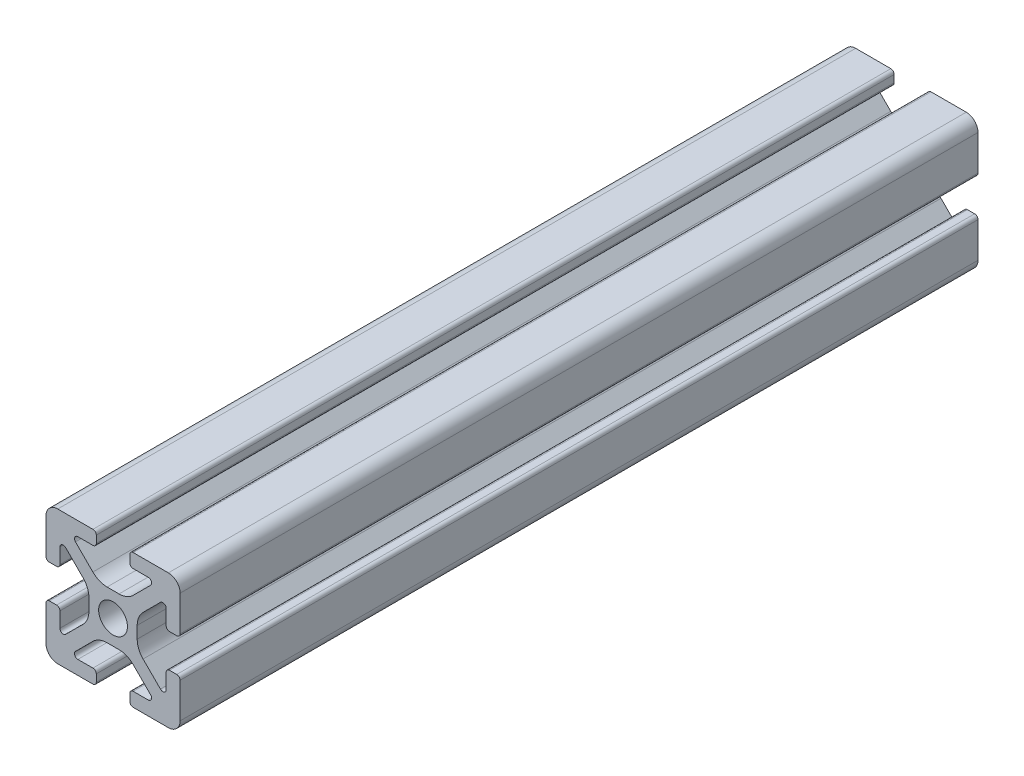
from build123d import *

# Parameters (mm, degrees)
BOSS_EXTRUDE1_DEPTH = 59.505


with BuildPart() as part:
    # Sketch4 → Boss-Extrude1 (new, symmetric)
    with BuildSketch(Plane.XY):
        with BuildLine():
            Line((3, -10), (8.25, -10))
            ThreePointArc((8.25, -10), (9.487436867, -9.487436867), (10, -8.25))
            Line((10, -8.25), (10, -3))
            ThreePointArc((10, -3), (9.853553391, -2.646446609), (9.5, -2.5))
            Line((9.5, -2.5), (8.424621202, -2.5))
            ThreePointArc((8.424621202, -2.5), (8.071067812, -2.646446609), (7.924621202, -3))
            Line((7.924621202, -3), (7.924621202, -5.25))
            ThreePointArc((7.924621202, -5.25), (7.615962919, -5.711939766), (7.071067812, -5.603553391))
            Line((7.071067812, -5.603553391), (4.478679656, -3.011165235))
            ThreePointArc((4.478679656, -3.011165235), (3.828361402, -2.037895189), (3.6, -0.889844892))
            Line((3.6, -0.889844892), (3.6, 0))
            Line((3.6, 0), (2.15, 0))
            ThreePointArc((2.15, 0), (1.52027958, -1.52027958), (0, -2.15))
            Line((0, -2.15), (0, -3.6))
            Line((0, -3.6), (0.889844892, -3.6))
            ThreePointArc((0.889844892, -3.6), (2.037895189, -3.828361402), (3.011165235, -4.478679656))
            Line((3.011165235, -4.478679656), (5.603553391, -7.071067812))
            ThreePointArc((5.603553391, -7.071067812), (5.711939766, -7.615962919), (5.25, -7.924621202))
            Line((5.25, -7.924621202), (3, -7.924621202))
            ThreePointArc((3, -7.924621202), (2.646446609, -8.071067812), (2.5, -8.424621202))
            Line((2.5, -8.424621202), (2.5, -9.5))
            ThreePointArc((2.5, -9.5), (2.646446609, -9.853553391), (3, -10))
        make_face()
    extrude(amount=BOSS_EXTRUDE1_DEPTH, both=True)

    # Mirror1: part across plane


with BuildPart() as part_1:
    add(part.part)
    add(part.part.mirror(Plane(origin=(0, 0, 0), x_dir=(0, 0, 1), z_dir=(1, 0, 0))))

    # Mirror2: part across plane


with BuildPart() as part_2:
    add(part_1.part)
    add(part_1.part.mirror(Plane.ZX))


solid = part_2.part
